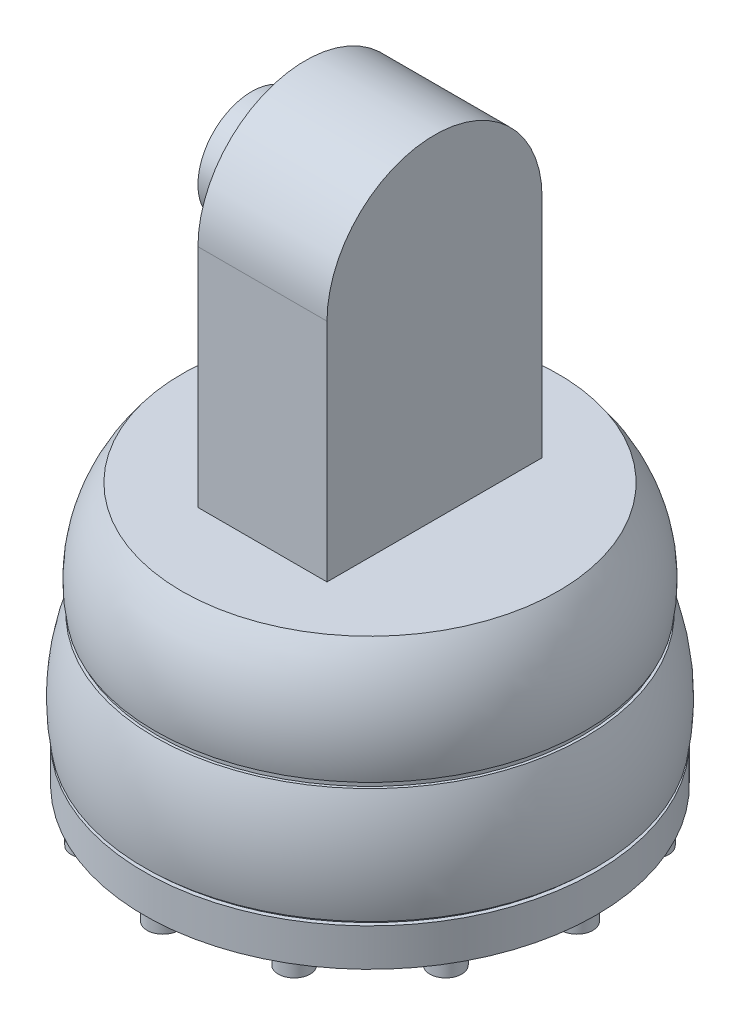
from build123d import *

# Parameters (mm, degrees)
SKETCH2_R            = 39.5
BOSS_EXTRUDE1_DEPTH  = 1
SKETCH4_R            = 41.25
BOSS_EXTRUDE2_DEPTH  = 0.7
SKETCH5_R            = 42
BOSS_EXTRUDE3_DEPTH  = 7
SKETCH6_R            = 35
BOSS_EXTRUDE4_DEPTH  = 3
SKETCH7_R            = 2.959266208
BOSS_EXTRUDE5_DEPTH  = 2.7
SKETCH8_R            = 2.259266208
CUT_EXTRUDE1_DEPTH   = 0.5
CIRPATTERN1_COUNT    = 12
SKETCH9_W            = 24
SKETCH9_H            = 40
BOSS_EXTRUDE6_DEPTH  = 42
BOSS_EXTRUDE7_DEPTH  = 24
SKETCH13_R           = 10
BOSS_EXTRUDE10_DEPTH = 10
SKETCH14_R           = 10
BOSS_EXTRUDE11_DEPTH = 10


with BuildPart() as part:
    # Sketch1 → Revolve1 (revolve)
    with BuildSketch(Plane.XY, mode=Mode.PRIVATE) as revolve1_sk:
        with BuildLine():
            Line((0, 0), (-35, 0))
            ThreePointArc((-35, 0), (-39.657515479, -9.46062113), (-40, -20))
            Line((-40, -20), (0, -20))
            Line((0, -20), (0, 0))
        make_face()
    revolve(revolve1_sk.sketch.rotate(Axis((0, 0, 0), (0, -1, 0)), 270), axis=Axis((0, 0, 0), (0, -1, 0)))

    # Sketch2 → Boss-Extrude1 (add)
    with BuildSketch(Plane.XZ.offset(20)):
        with Locations(Location((0, 0, 0), (0, 0, 270))):
            Circle(SKETCH2_R)
    extrude(amount=BOSS_EXTRUDE1_DEPTH)

    # Sketch3 → Revolve2 (revolve)
    with BuildSketch(Plane.XY, mode=Mode.PRIVATE) as revolve2_sk:
        with BuildLine():
            Line((0, -21), (-40, -21))
            ThreePointArc((-40, -21), (-42.384109041, -30.861589096), (-42, -41))
            Line((-42, -41), (0, -41))
            Line((0, -41), (0, -21))
        make_face()
    revolve(revolve2_sk.sketch.rotate(Axis((0, -21, 0), (0, -1, 0)), 270), axis=Axis((0, -21, 0), (0, -1, 0)))

    # Sketch4 → Boss-Extrude2 (add)
    with BuildSketch(Plane.XZ.offset(41)):
        Circle(SKETCH4_R)
    extrude(amount=BOSS_EXTRUDE2_DEPTH)

    # Sketch5 → Boss-Extrude3 (add)
    with BuildSketch(Plane.XZ.offset(41.7)):
        Circle(SKETCH5_R)
    extrude(amount=BOSS_EXTRUDE3_DEPTH)

    # Sketch6 → Boss-Extrude4 (add)
    with BuildSketch(Plane.XZ.offset(48.7)):
        Circle(SKETCH6_R)
    extrude(amount=BOSS_EXTRUDE4_DEPTH)

    # Sketch7 → Boss-Extrude5 (add)
    with BuildSketch(Plane.XZ.offset(48.7)):
        with Locations(Location((38.5, 0, 0), (0, 0, 180))):
            Circle(SKETCH7_R)
    boss_extrude5 = extrude(amount=BOSS_EXTRUDE5_DEPTH)

    # Sketch8 → Cut-Extrude1 (cut)
    with BuildSketch(Plane.XZ.offset(51.4)):
        with Locations((38.5, 0)):
            Circle(SKETCH8_R)
    cut_extrude1 = extrude(amount=-CUT_EXTRUDE1_DEPTH, mode=Mode.SUBTRACT)

    # CirPattern1: Boss-Extrude5, Cut-Extrude1 ×12 about axis
    cirpattern1_axis = Axis((0, 0, 0), (0, 1, 0))
    add([boss_extrude5.rotate(cirpattern1_axis, i * 360 / CIRPATTERN1_COUNT) for i in range(1, CIRPATTERN1_COUNT)])
    add([cut_extrude1.rotate(cirpattern1_axis, i * 360 / CIRPATTERN1_COUNT) for i in range(1, CIRPATTERN1_COUNT)], mode=Mode.SUBTRACT)

    # Sketch9 → Boss-Extrude6 (add)
    with BuildSketch(Plane(origin=(0, 0, 0), x_dir=(1, 0, 0), z_dir=(0, 1, 0))):
        Rectangle(SKETCH9_W, SKETCH9_H)
    extrude(amount=BOSS_EXTRUDE6_DEPTH)

    # Sketch10 → Boss-Extrude7 (add)
    with BuildSketch(Plane(origin=(12, 0, 0), x_dir=(0, 0, -1), z_dir=(1, 0, 0))):
        with BuildLine():
            Line((-20, 42), (20, 42))
            ThreePointArc((20, 42), (0, 62), (-20, 42))
        make_face()
    extrude(amount=-BOSS_EXTRUDE7_DEPTH)

    # Sketch13 → Boss-Extrude10 (add)
    with BuildSketch(Plane.ZY.offset(12)):
        with Locations(Location((0, 42, 0), (0, 0, 180))):
            Circle(SKETCH13_R)
    extrude(amount=BOSS_EXTRUDE10_DEPTH)

    # Sketch14 → Boss-Extrude11 (add)
    with BuildSketch(Plane.XZ.offset(51.7)):
        Circle(SKETCH14_R)
    extrude(amount=BOSS_EXTRUDE11_DEPTH)


solid = part.part
